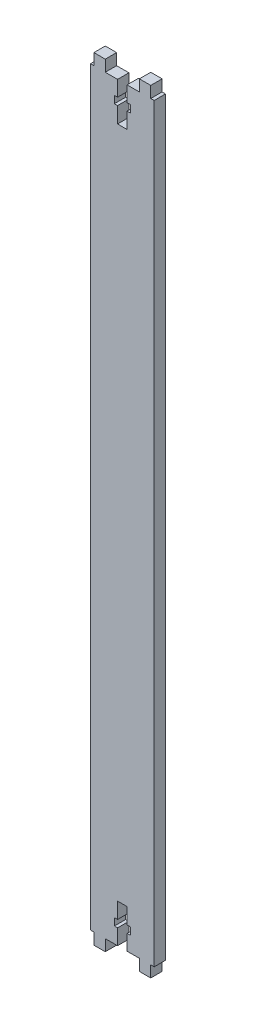
from build123d import *

# Parameters (mm, degrees)
SKETCH1_W           = 5
SKETCH1_H           = 5
BOSS_EXTRUDE1_DEPTH = 5


with BuildPart() as part:
    # Sketch1 → Boss-Extrude1 (new body)
    with BuildSketch(Plane.XY):
        with Locations((-4, 332.5)):
            Rectangle(SKETCH1_W, SKETCH1_H)
        with Locations((-24, 332.5)):
            Rectangle(SKETCH1_W, SKETCH1_H)
        Polygon((-26.5, 330), (-28, 330), (-28, 0), (-26.5, 0), (-21.5, 0), (-16.1, 0), (-16.1, 6.8), (-17.5, 6.8), (-17.5, 10), (-16.1, 10), (-16.1, 17), (-11.9, 17), (-11.9, 10), (-10.5, 10), (-10.5, 6.8), (-11.9, 6.8), (-11.9, 0), (-6.5, 0), (-1.5, 0), (0, 0), (0, 330), (-1.5, 330), (-6.5, 330), (-11.9, 330), (-11.9, 323.2), (-10.5, 323.2), (-10.5, 320), (-11.9, 320), (-11.9, 313), (-16.1, 313), (-16.1, 320), (-17.5, 320), (-17.5, 323.2), (-16.1, 323.2), (-16.1, 330), (-21.5, 330), align=None)
        with Locations((-4, -2.5)):
            Rectangle(SKETCH1_W, SKETCH1_H)
        with Locations((-24, -2.5)):
            Rectangle(SKETCH1_W, SKETCH1_H)
    extrude(amount=BOSS_EXTRUDE1_DEPTH)


solid = part.part
